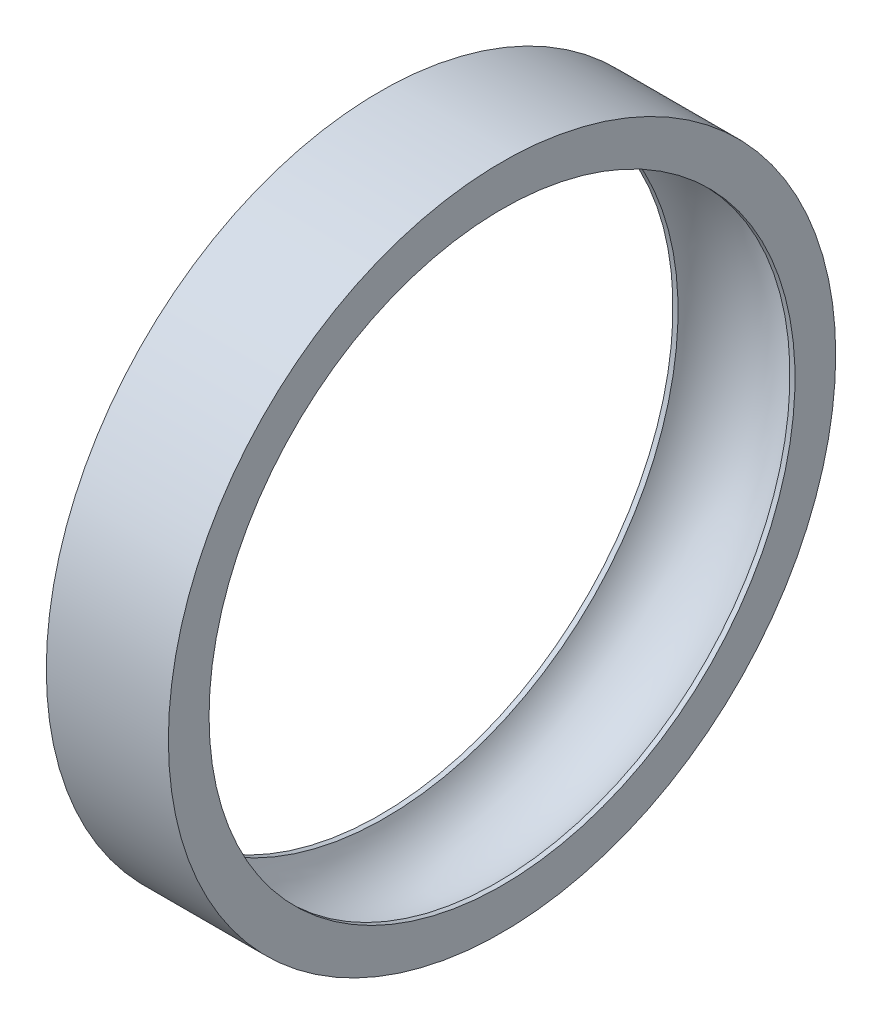
from build123d import *

# Parameters (mm, degrees)
SCALE1_SCALE = 1.9329
SCALE2_SCALE = 1.5


with BuildPart() as part:
    # Sketch3 → Revolve1 (revolve)
    with BuildSketch(Plane.XY, mode=Mode.PRIVATE) as revolve1_sk:
        with BuildLine():
            Line((-7.5, 36), (-7.5, 41))
            Line((-7.5, 41), (7.5, 41))
            Line((7.5, 41), (7.5, 36))
            Line((7.5, 36), (6.873863542, 36))
            ThreePointArc((6.873863542, 36), (0, 40.5), (-6.873863542, 36))
            Line((-6.873863542, 36), (-7.5, 36))
        make_face()
    revolve(revolve1_sk.sketch.rotate(Axis((0, 0, 0), (1, 0, 0)), 90), axis=Axis((0, 0, 0), (1, 0, 0)))


with BuildPart() as part_1:
    # Scale1: scaled about (0, 0, 0)
    add(part.part.scale(SCALE1_SCALE))


with BuildPart() as part_2:
    # Scale2: scaled about (0, 0, 0)
    add(part_1.part.scale(SCALE2_SCALE))


solid = part_2.part
